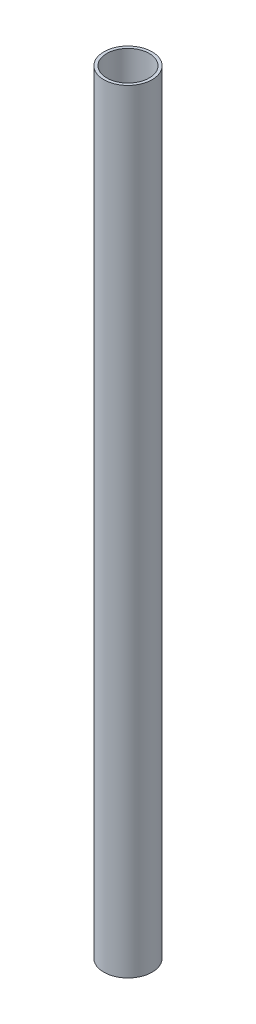
from build123d import *

# Parameters (mm, degrees)
SKETCH3_R           = 12.5
SKETCH3_R_2         = 11
EXTRUDE_THIN1_DEPTH = 400


with BuildPart() as part:
    # Sketch3 → Extrude-Thin1 (new body)
    with BuildSketch(Plane(origin=(0, 0, 0), x_dir=(1, 0, 0), z_dir=(0, 1, 0))):
        Circle(SKETCH3_R)
        Circle(SKETCH3_R_2, mode=Mode.SUBTRACT)
    extrude(amount=EXTRUDE_THIN1_DEPTH)


solid = part.part
